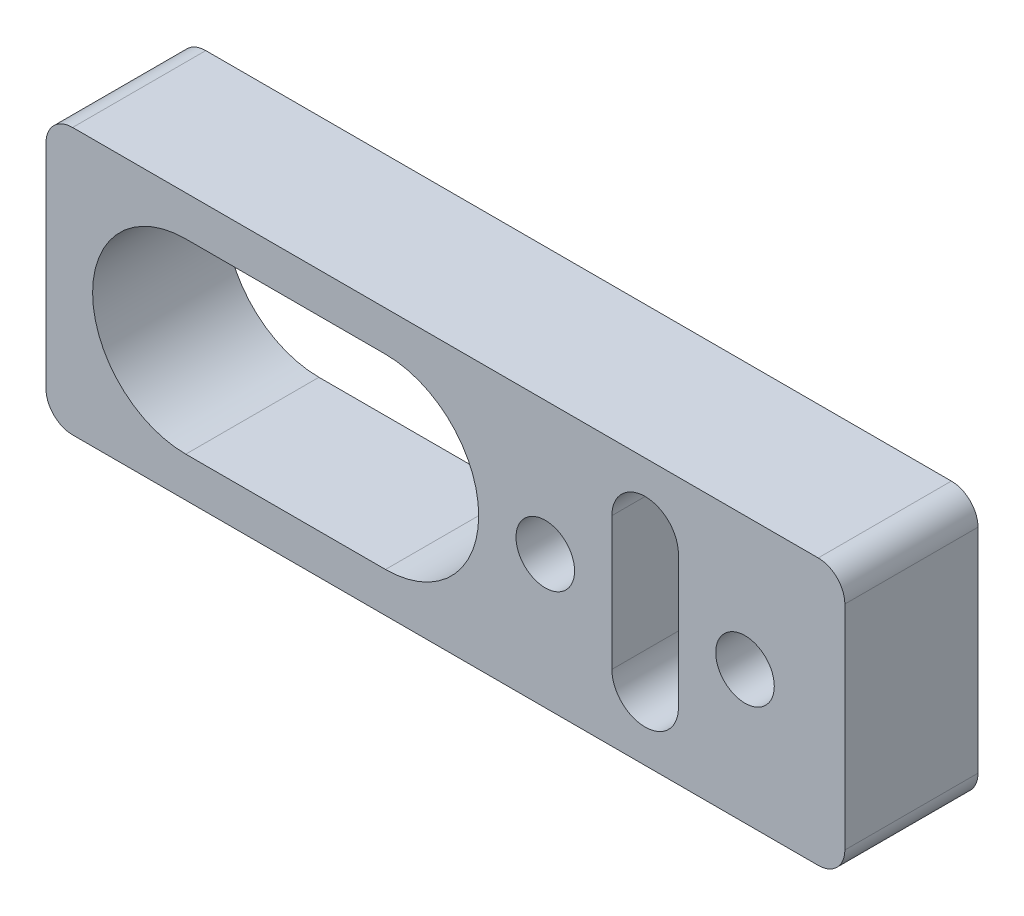
from build123d import *

# Parameters (mm, degrees)
SKETCH_1_W          = 60
SKETCH_1_H          = 20
EXTRUDE_1_DEPTH     = 10
FILLET_1_R          = 2
SKETCH_2_R          = 2.2
CUT_EXTRUDE_1_DEPTH = 34.166247904
CUT_EXTRUDE_2_DEPTH = 34.166247904


with BuildPart() as part:
    # 草图1 → 凸台-拉伸1 (new body)
    with BuildSketch(Plane.XY):
        Rectangle(SKETCH_1_W, SKETCH_1_H)
    extrude(amount=EXTRUDE_1_DEPTH)

    # 圆角1
    fillet_1_edges = [part.edges().sort_by_distance(p)[0] for p in [
        (30, -10, 5),
        (-30, -10, 5),
        (-30, 10, 5),
        (30, 10, 5),
    ]]
    fillet(fillet_1_edges, radius=FILLET_1_R)

    # 草图2 → 切除-拉伸1 (cut, through all)
    with BuildSketch(Plane.XY.offset(10)):
        with Locations((22.5, 0)):
            Circle(SKETCH_2_R)
        with Locations((7.5, 0)):
            Circle(SKETCH_2_R)
    extrude(amount=-CUT_EXTRUDE_1_DEPTH, mode=Mode.SUBTRACT)

    # 草图3 → 切除-拉伸2 (cut, through all)
    with BuildSketch(Plane.XY.offset(10)):
        with BuildLine():
            Line((-19.5, 7), (-4.5, 7))
            ThreePointArc((-4.5, 7), (2.5, 0), (-4.5, -7))
            Line((-4.5, -7), (-19.5, -7))
            ThreePointArc((-19.5, -7), (-26.5, 0), (-19.5, 7))
        make_face()
        with BuildLine():
            Line((12.5, -5), (12.5, 5))
            ThreePointArc((12.5, 5), (15, 7.5), (17.5, 5))
            Line((17.5, 5), (17.5, -5))
            ThreePointArc((17.5, -5), (15, -7.5), (12.5, -5))
        make_face()
    extrude(amount=-CUT_EXTRUDE_2_DEPTH, mode=Mode.SUBTRACT)


solid = part.part
